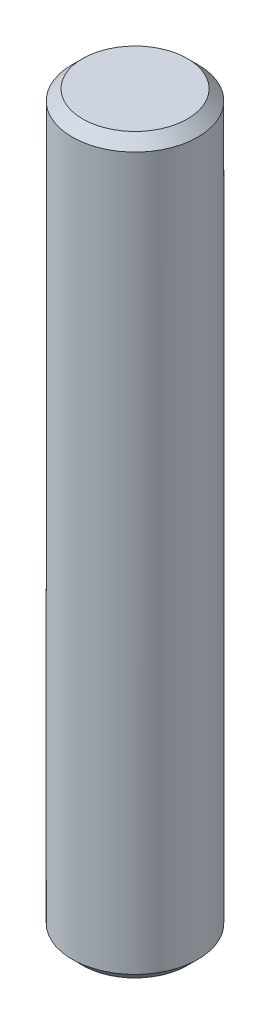
from build123d import *

# Parameters (mm, degrees)
SKETCH1_W     = 6
SKETCH1_H     = 70
CHAMFER1_SIZE = 1


with BuildPart() as part:
    # Sketch1 → Revolve1 (revolve)
    with BuildSketch(Plane(origin=(0, 0, 0), x_dir=(0, 0, -1), z_dir=(1, 0, 0))):
        with Locations((3, 35)):
            Rectangle(SKETCH1_W, SKETCH1_H)
    revolve(axis=Axis((0, 0, 0), (0, 1, 0)))

    # Chamfer1
    chamfer1_edges = [part.edges().sort_by_distance(p)[0] for p in [
        (0, 0, 6),
        (0, 70, 6),
    ]]
    chamfer(chamfer1_edges, length=CHAMFER1_SIZE)


solid = part.part
